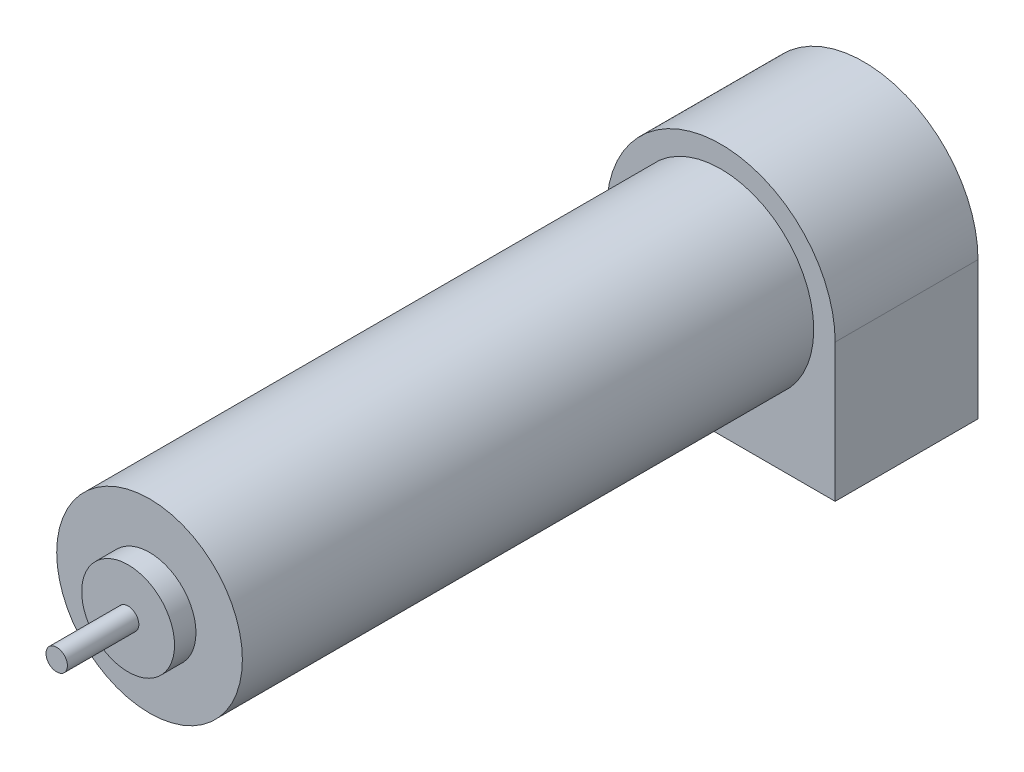
from build123d import *

# Parameters (mm, degrees)
ESQUISSE1_R      = 13
EXTRUSION1_DEPTH = 80
ESQUISSE2_R      = 6.5
EXTRUSION2_DEPTH = 3
ESQUISSE3_R      = 1.5
EXTRUSION3_DEPTH = 10
EXTRUSION5_DEPTH = 20


with BuildPart() as part:
    # Esquisse1 → Extrusion1 (new body)
    with BuildSketch(Plane.XY):
        Circle(ESQUISSE1_R)
    extrude(amount=EXTRUSION1_DEPTH)

    # Esquisse2 → Extrusion2 (add)
    with BuildSketch(Plane.XY.offset(80)):
        Circle(ESQUISSE2_R)
    extrude(amount=EXTRUSION2_DEPTH)

    # Esquisse3 → Extrusion3 (add)
    with BuildSketch(Plane.XY.offset(83)):
        Circle(ESQUISSE3_R)
    extrude(amount=EXTRUSION3_DEPTH)

    # Esquisse4 → Extrusion5 (add)
    with BuildSketch(Plane(origin=(0, 0, 0), x_dir=(-1, 0, 0), z_dir=(0, 0, -1))):
        with BuildLine():
            Line((-16, 0), (-16, -19.313261222))
            Line((-16, -19.313261222), (16, -19.313261222))
            Line((16, -19.313261222), (16, 0))
            ThreePointArc((16, 0), (0, 16), (-16, 0))
        make_face()
    extrude(amount=EXTRUSION5_DEPTH)


solid = part.part
